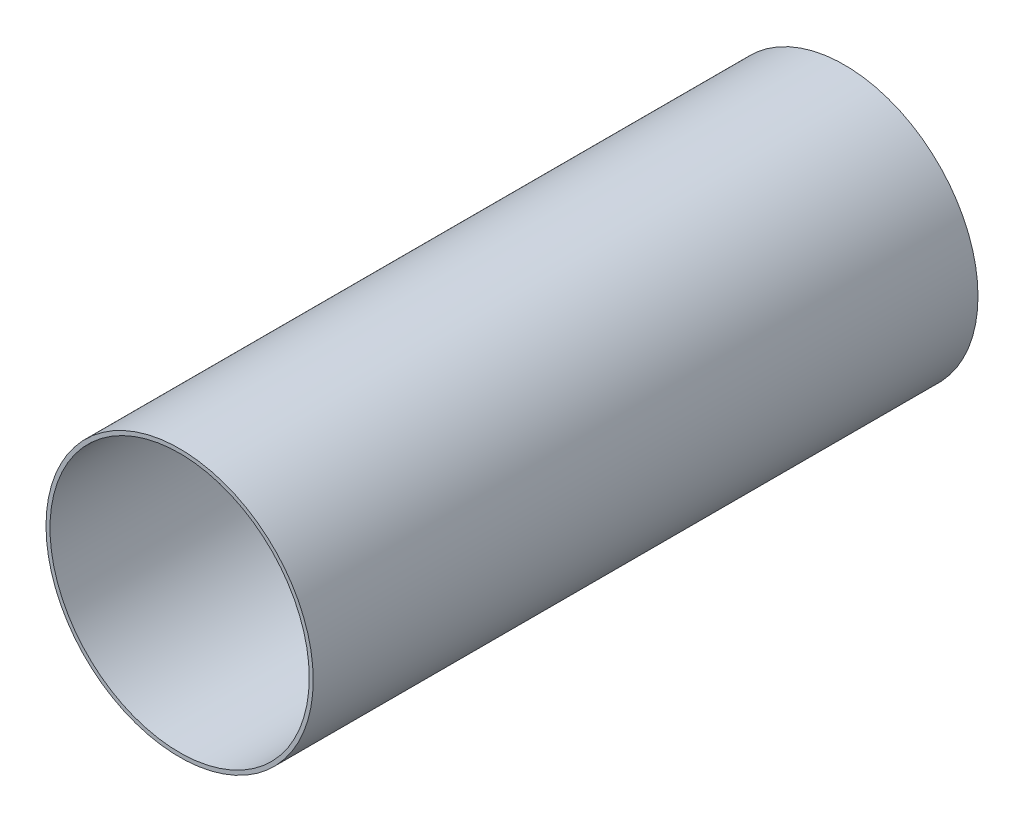
from build123d import *

# Parameters (mm, degrees)
SKETCH1_R           = 51.054
SKETCH1_R_2         = 49.53
BOSS_EXTRUDE1_DEPTH = 254


with BuildPart() as part:
    # Sketch1 → Boss-Extrude1 (new body)
    with BuildSketch(Plane.XY):
        Circle(SKETCH1_R)
        Circle(SKETCH1_R_2, mode=Mode.SUBTRACT)
    extrude(amount=BOSS_EXTRUDE1_DEPTH)


solid = part.part
